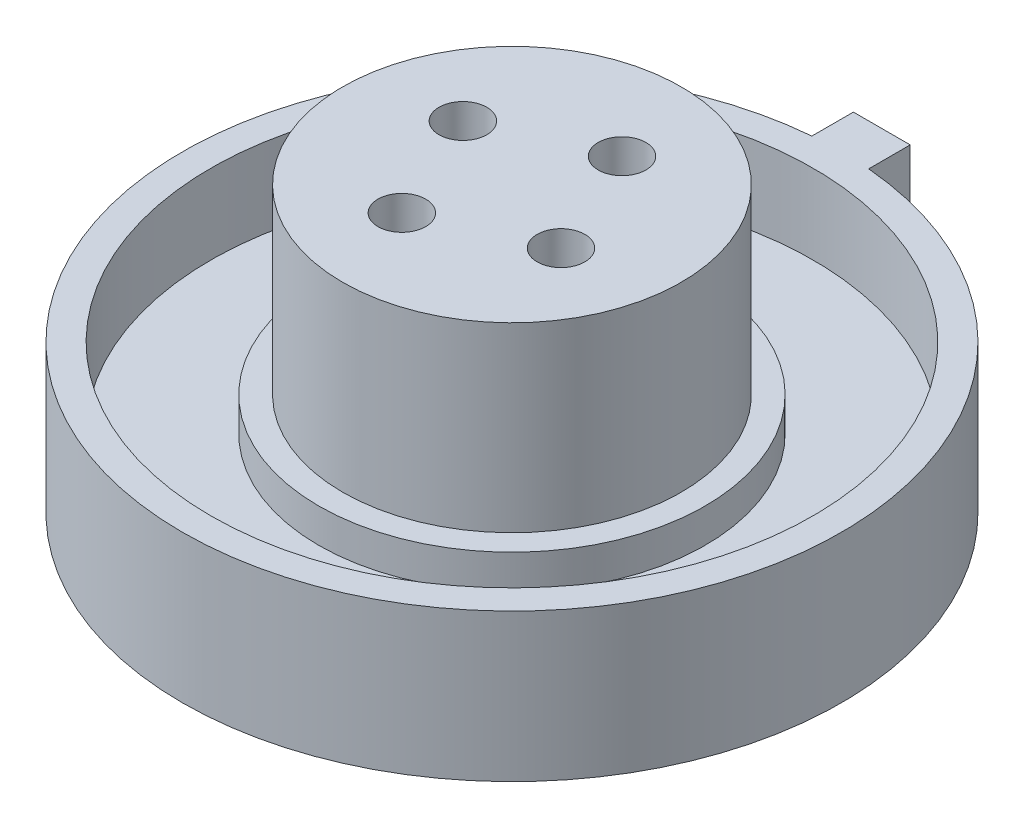
from build123d import *

# Parameters (mm, degrees)
SKETCH1_R           = 29
BOSS_EXTRUDE1_DEPTH = 13
SKETCH2_R           = 26.5
SKETCH2_R_2         = 17
CUT_EXTRUDE1_DEPTH  = 7
SKETCH4_R           = 17.25
CUT_EXTRUDE3_DEPTH  = 4
SKETCH5_W           = 5
SKETCH5_H           = 4.624873007
BOSS_EXTRUDE2_DEPTH = 13
SKETCH6_R           = 14.9
BOSS_EXTRUDE3_DEPTH = 16
SKETCH3_R           = 2.1
CUT_EXTRUDE2_DEPTH  = 30


with BuildPart() as part:
    # Sketch1 → Boss-Extrude1 (new body)
    with BuildSketch(Plane(origin=(0, 0, 0), x_dir=(1, 0, 0), z_dir=(0, 1, 0))):
        with Locations(Location((0, 0, 0), (0, 0, 90))):
            Circle(SKETCH1_R)
    extrude(amount=BOSS_EXTRUDE1_DEPTH)

    # Sketch2 → Cut-Extrude1 (cut)
    with BuildSketch(Plane(origin=(0, 13, 0), x_dir=(1, 0, 0), z_dir=(0, 1, 0))):
        with Locations(Location((0, 0, 0), (0, 0, 270))):
            Circle(SKETCH2_R)
        with Locations(Location((0, 0, 0), (0, 0, 270))):
            Circle(SKETCH2_R_2, mode=Mode.SUBTRACT)
    extrude(amount=-CUT_EXTRUDE1_DEPTH, mode=Mode.SUBTRACT)

    # Sketch4 → Cut-Extrude3 (cut)
    with BuildSketch(Plane(origin=(0, 13, 0), x_dir=(1, 0, 0), z_dir=(0, 1, 0))):
        Circle(SKETCH4_R)
    extrude(amount=-CUT_EXTRUDE3_DEPTH, mode=Mode.SUBTRACT)

    # Sketch5 → Boss-Extrude2 (add)
    with BuildSketch(Plane.XZ):
        with Locations((0, -30.234113057)):
            Rectangle(SKETCH5_W, SKETCH5_H)
    extrude(amount=-BOSS_EXTRUDE2_DEPTH)

    # Sketch6 → Boss-Extrude3 (add)
    with BuildSketch(Plane(origin=(0, 9, 0), x_dir=(1, 0, 0), z_dir=(0, 1, 0))):
        with Locations(Location((0, 0, 0), (0, 0, 270))):
            Circle(SKETCH6_R)
    extrude(amount=BOSS_EXTRUDE3_DEPTH)

    # Sketch3 → Cut-Extrude2 (cut)
    with BuildSketch(Plane.XZ):
        with Locations(Location((7.002624358, 2.68574982, 0), (0, 0, 270))):
            Circle(SKETCH3_R)
        with Locations(Location((-7.002624358, -2.68574982, 0), (0, 0, 270))):
            Circle(SKETCH3_R)
        with Locations(Location((2.68574982, -7.002624358, 0), (0, 0, 270))):
            Circle(SKETCH3_R)
        with Locations(Location((-2.68574982, 7.002624358, 0), (0, 0, 270))):
            Circle(SKETCH3_R)
    extrude(amount=-CUT_EXTRUDE2_DEPTH, mode=Mode.SUBTRACT)


solid = part.part
